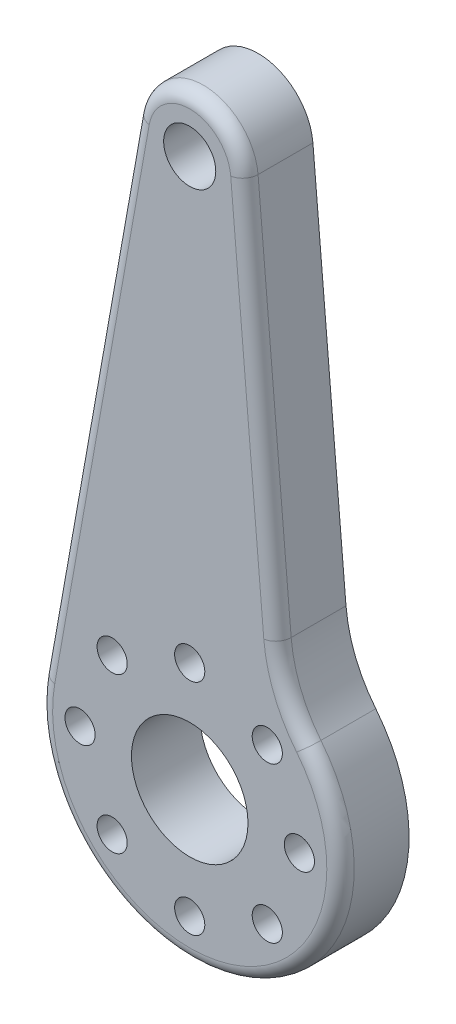
from build123d import *
from build123d.topology import SkipClean

# Parameters (mm, degrees)
SKETCH1_R             = 1.9
SKETCH1_R_2           = 4.25
SKETCH1_R_3           = 1.1
BOSS_EXTRUDE1_DEPTH   = 5
SKETCH4_R             = 1.75
CUT_EXTRUDE3_DEPTH    = 2.25
CORTAR_EXTRUIR1_DEPTH = 10
REDONDEO1_R           = 10
REDONDEO3_R           = 1


with BuildPart() as part:
    # Sketch1 → Boss-Extrude1 (new body)
    with BuildSketch(Plane.XY):
        with BuildLine():
            Line((-18.926637777, 20.351096398), (-25.818616811, -18.423903602))
            ThreePointArc((-25.818616811, -18.423903602), (-14.988364044, -31.348903602), (-4.158111277, -18.423903602))
            Line((-4.158111277, -18.423903602), (-11.05009031, 20.351096398))
            ThreePointArc((-11.05009031, 20.351096398), (-14.988364044, 23.651096398), (-18.926637777, 20.351096398))
        make_face()
        with Locations((-14.988364044, 19.651096398)):
            Circle(SKETCH1_R, mode=Mode.SUBTRACT)
        with Locations((-14.988364044, -20.348903602)):
            Circle(SKETCH1_R_2, mode=Mode.SUBTRACT)
        with Locations((-6.988364044, -20.348903602)):
            Circle(SKETCH1_R_3, mode=Mode.SUBTRACT)
        with Locations((-9.331509794, -26.005757851)):
            Circle(SKETCH1_R_3, mode=Mode.SUBTRACT)
        with Locations((-14.988364044, -28.348903602)):
            Circle(SKETCH1_R_3, mode=Mode.SUBTRACT)
        with Locations((-20.645218293, -26.005757851)):
            Circle(SKETCH1_R_3, mode=Mode.SUBTRACT)
        with Locations((-22.988364044, -20.348903602)):
            Circle(SKETCH1_R_3, mode=Mode.SUBTRACT)
        with Locations((-20.645218293, -14.692049352)):
            Circle(SKETCH1_R_3, mode=Mode.SUBTRACT)
        with Locations((-14.988364044, -12.348903602)):
            Circle(SKETCH1_R_3, mode=Mode.SUBTRACT)
        with Locations((-9.331509794, -14.692049352)):
            Circle(SKETCH1_R_3, mode=Mode.SUBTRACT)
    extrude(amount=BOSS_EXTRUDE1_DEPTH)

    # Sketch4 → Cut-Extrude3 (cut)
    with BuildSketch(Plane(origin=(0, 0, 0), x_dir=(-1, 0, 0), z_dir=(0, 0, -1))):
        with Locations((22.988364044, -20.348903602)):
            Circle(SKETCH4_R)
        with Locations((20.645218293, -26.005757851)):
            Circle(SKETCH4_R)
        with Locations((14.988364044, -28.348903602)):
            Circle(SKETCH4_R)
        with Locations((9.331509794, -26.005757851)):
            Circle(SKETCH4_R)
        with Locations((6.988364044, -20.348903602)):
            Circle(SKETCH4_R)
        with Locations((9.331509794, -14.692049352)):
            Circle(SKETCH4_R)
        with Locations((14.988364044, -12.348903602)):
            Circle(SKETCH4_R)
        with Locations((20.645218293, -14.692049352)):
            Circle(SKETCH4_R)
    extrude(amount=-CUT_EXTRUDE3_DEPTH, mode=Mode.SUBTRACT)

    # Croquis1 → Cortar-Extruir1 (cut)
    with SkipClean():  # the faces are left unmerged after this step: merging them gives an invalid solid
        with BuildSketch(Plane(origin=(0, 0, 0), x_dir=(-1, 0, 0), z_dir=(0, 0, -1))):
            with BuildLine():
                Line((11.003110402, 19.994248567), (8.279982388, -11.631242473))
                ThreePointArc((8.279982388, -11.631242473), (5.584323122, -14.642414809), (4.158111277, -18.423903602))
                Line((4.158111277, -18.423903602), (11.05009031, 20.351096398))
                ThreePointArc((11.05009031, 20.351096398), (11.022584598, 20.173201167), (11.003110402, 19.994248567))
            make_face()
        extrude(amount=-CORTAR_EXTRUIR1_DEPTH, mode=Mode.SUBTRACT)

    # Redondeo1
    redondeo1_edges = [part.edges().sort_by_distance(p)[0] for p in [
        (-8.279982388, -11.631242473, 2.5),
    ]]
    fillet(redondeo1_edges, radius=REDONDEO1_R)

    # Redondeo3
    redondeo3_edges = [part.edges().sort_by_distance(p)[0] for p in [
        (-14.988364044, -31.348903602, 5),
        (-9.795996729, 5.975237179, 5),
        (-7.906176898, -10.910629635, 5),
        (-14.988364044, 23.651096398, 5),
        (-22.372627294, 0.963596398, 5),
    ]]
    fillet(redondeo3_edges, radius=REDONDEO3_R)


solid = part.part
